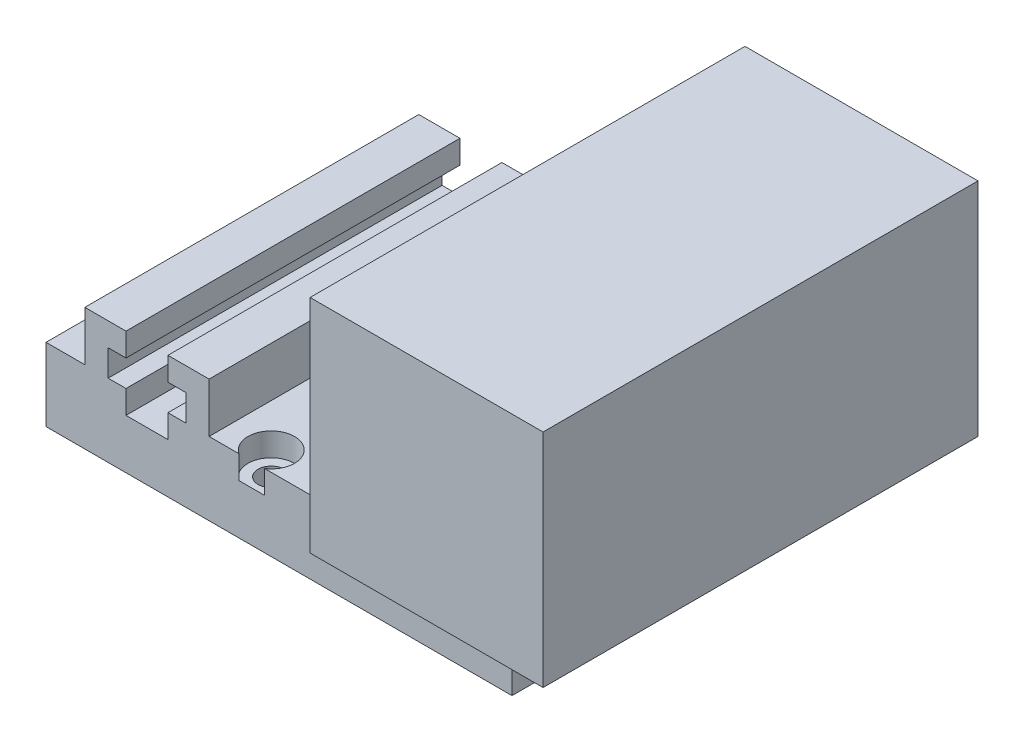
from build123d import *

# Parameters (mm, degrees)
SKETCH1_W           = 60
SKETCH1_H           = 43
BOSS_EXTRUDE1_DEPTH = 5
SKETCH2_W           = 60
SKETCH2_H           = 5
BOSS_EXTRUDE2_DEPTH = 4.4
SKETCH3_W           = 3
SKETCH3_H           = 43
BOSS_EXTRUDE3_DEPTH = 6.4
SKETCH4_W           = 43
SKETCH4_H           = 3
BOSS_EXTRUDE4_DEPTH = 2.3
SKETCH5_W           = 30
SKETCH5_H           = 56
BOSS_EXTRUDE5_DEPTH = 28.5
SKETCH6_W           = 40.4
SKETCH6_H           = 20.4
CUT_EXTRUDE1_DEPTH  = 28
SKETCH7_R           = 1.05
CUT_EXTRUDE2_DEPTH  = 25
CUT_EXTRUDE3_REACH  = 94.427
SKETCH8_W           = 5.4
SKETCH8_H           = 3
CUT_EXTRUDE4_REACH  = 92.735
SKETCH9_R           = 1.7
SKETCH10_R          = 3
CUT_EXTRUDE5_DEPTH  = 3


with BuildPart() as part:
    # Sketch1 → Boss-Extrude1 (new body)
    with BuildSketch(Plane(origin=(0, 0, 0), x_dir=(1, 0, 0), z_dir=(0, 1, 0))):
        with Locations((30, 21.5)):
            Rectangle(SKETCH1_W, SKETCH1_H)
    extrude(amount=BOSS_EXTRUDE1_DEPTH)

    # Sketch2 → Boss-Extrude2 (add)
    with BuildSketch(Plane(origin=(0, 0, 0), x_dir=(-1, 0, 0), z_dir=(0, -1, 0))):
        with Locations((-30, 2.5)):
            Rectangle(SKETCH2_W, SKETCH2_H)
        with Locations((-30, 40.5)):
            Rectangle(SKETCH2_W, SKETCH2_H)
    extrude(amount=BOSS_EXTRUDE2_DEPTH)

    # Sketch3 → Boss-Extrude3 (add)
    with BuildSketch(Plane(origin=(0, 5, 0), x_dir=(1, 0, 0), z_dir=(0, 1, 0))):
        with Locations((6.5, 21.5)):
            Rectangle(SKETCH3_W, SKETCH3_H)
        with Locations((19.5, 21.5)):
            Rectangle(SKETCH3_W, SKETCH3_H)
    extrude(amount=BOSS_EXTRUDE3_DEPTH)

    # Sketch4 → Boss-Extrude4 (add)
    with BuildSketch(Plane(origin=(8, 0, 0), x_dir=(0, 0, -1), z_dir=(1, 0, 0))):
        with Locations((21.5, 9.9)):
            Rectangle(SKETCH4_W, SKETCH4_H)
    boss_extrude4 = extrude(amount=BOSS_EXTRUDE4_DEPTH)

    # Mirror1: Boss-Extrude4 across plane
    add(boss_extrude4.mirror(Plane(origin=(13, 0, 0), x_dir=(0, 0, 1), z_dir=(1, 0, 0))))

    # Sketch5 → Boss-Extrude5 (add)
    with BuildSketch(Plane(origin=(0, 5, 0), x_dir=(1, 0, 0), z_dir=(0, 1, 0))):
        with Locations((55.5, 21.5)):
            Rectangle(SKETCH5_W, SKETCH5_H)
    extrude(amount=BOSS_EXTRUDE5_DEPTH)

    # Sketch6 → Cut-Extrude1 (cut)
    with BuildSketch(Plane.ZY.offset(-40.5)):
        with Locations((-21.5, 20.5)):
            Rectangle(SKETCH6_W, SKETCH6_H)
    extrude(amount=-CUT_EXTRUDE1_DEPTH, mode=Mode.SUBTRACT)

    # Sketch7 → Cut-Extrude2 (cut)
    with BuildSketch(Plane.ZY.offset(-40.5)):
        with Locations((-46, 25.5)):
            Circle(SKETCH7_R)
        with Locations((-46, 15.5)):
            Circle(SKETCH7_R)
        with Locations((3, 25.5)):
            Circle(SKETCH7_R)
        with Locations((3, 15.5)):
            Circle(SKETCH7_R)
    extrude(amount=-CUT_EXTRUDE2_DEPTH, mode=Mode.SUBTRACT)

    # Sketch8 → Cut-Extrude3 (cut, up to next)
    with BuildSketch(Plane.XY, mode=Mode.PRIVATE) as cut_extrude3_sk1:
        with Locations((13, 3.5)):
            Rectangle(SKETCH8_W, SKETCH8_H)
    cut_extrude3_tool1 = extrude(cut_extrude3_sk1.sketch, amount=-CUT_EXTRUDE3_REACH, mode=Mode.PRIVATE) & part.part
    add(cut_extrude3_tool1.solids().sort_by_distance((13, 3.5, 0))[0], mode=Mode.SUBTRACT)

    # Sketch9 → Cut-Extrude4 (cut, up to next)
    with BuildSketch(Plane(origin=(0, 5, 0), x_dir=(1, 0, 0), z_dir=(0, 1, 0)), mode=Mode.PRIVATE) as cut_extrude4_sk1:
        with Locations(Location((26.5, 40.5, 0), (0, 0, 270))):
            Circle(SKETCH9_R)
    cut_extrude4_tool1 = extrude(cut_extrude4_sk1.sketch, amount=-CUT_EXTRUDE4_REACH, mode=Mode.PRIVATE) & part.part
    # Sketch9 → Cut-Extrude4 (cut, up to next)
    with BuildSketch(Plane(origin=(0, 5, 0), x_dir=(1, 0, 0), z_dir=(0, 1, 0)), mode=Mode.PRIVATE) as cut_extrude4_sk2:
        with Locations(Location((36.5, 40.5, 0), (0, 0, 270))):
            Circle(SKETCH9_R)
    cut_extrude4_tool2 = extrude(cut_extrude4_sk2.sketch, amount=-CUT_EXTRUDE4_REACH, mode=Mode.PRIVATE) & part.part
    # Sketch9 → Cut-Extrude4 (cut, up to next)
    with BuildSketch(Plane(origin=(0, 5, 0), x_dir=(1, 0, 0), z_dir=(0, 1, 0)), mode=Mode.PRIVATE) as cut_extrude4_sk3:
        with Locations(Location((36.5, 2.5, 0), (0, 0, 90))):
            Circle(SKETCH9_R)
    cut_extrude4_tool3 = extrude(cut_extrude4_sk3.sketch, amount=-CUT_EXTRUDE4_REACH, mode=Mode.PRIVATE) & part.part
    # Sketch9 → Cut-Extrude4 (cut, up to next)
    with BuildSketch(Plane(origin=(0, 5, 0), x_dir=(1, 0, 0), z_dir=(0, 1, 0)), mode=Mode.PRIVATE) as cut_extrude4_sk4:
        with Locations(Location((26.5, 2.5, 0), (0, 0, 90))):
            Circle(SKETCH9_R)
    cut_extrude4_tool4 = extrude(cut_extrude4_sk4.sketch, amount=-CUT_EXTRUDE4_REACH, mode=Mode.PRIVATE) & part.part
    add(cut_extrude4_tool1.solids().sort_by_distance((26.5, 5, -40.5))[0], mode=Mode.SUBTRACT)
    add(cut_extrude4_tool2.solids().sort_by_distance((36.5, 5, -40.5))[0], mode=Mode.SUBTRACT)
    add(cut_extrude4_tool3.solids().sort_by_distance((36.5, 5, -2.5))[0], mode=Mode.SUBTRACT)
    add(cut_extrude4_tool4.solids().sort_by_distance((26.5, 5, -2.5))[0], mode=Mode.SUBTRACT)

    # Sketch10 → Cut-Extrude5 (cut)
    with BuildSketch(Plane(origin=(0, 5, 0), x_dir=(1, 0, 0), z_dir=(0, 1, 0))):
        with Locations((26.5, 40.5)):
            Circle(SKETCH10_R)
        with Locations((36.5, 40.5)):
            Circle(SKETCH10_R)
        with Locations((26.5, 2.5)):
            Circle(SKETCH10_R)
        with Locations((36.5, 2.5)):
            Circle(SKETCH10_R)
    extrude(amount=-CUT_EXTRUDE5_DEPTH, mode=Mode.SUBTRACT)


solid = part.part
